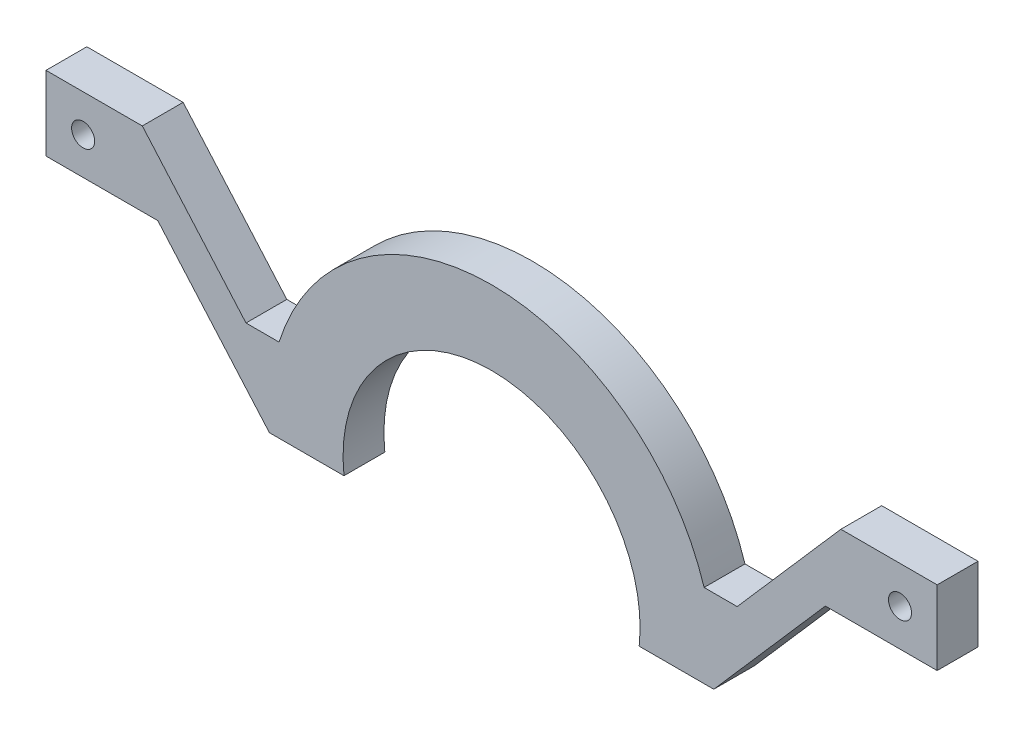
from build123d import *

# Parameters (mm, degrees)
EXTRUDE_1_DEPTH     = 5.5
SKETCH_2_R          = 1.55
CUT_EXTRUDE_1_DEPTH = 65.217448119


with BuildPart() as part:
    # ｽｹｯﾁ1 → ﾎﾞｽ - 押し出し1 (new body)
    with BuildSketch(Plane.XY):
        with BuildLine():
            Line((-60, 5), (-47.033321686, 5))
            Line((-47.033321686, 5), (-33.07098347, -11))
            Line((-33.07098347, -11), (-28.618176043, -11))
            ThreePointArc((-28.618176043, -11), (0, 10), (28.618176043, -11))
            Line((28.618176043, -11), (33.07098347, -11))
            Line((33.07098347, -11), (47.033321686, 5))
            Line((47.033321686, 5), (60, 5))
            Line((60, 5), (60, -5))
            Line((60, -5), (44.942957201, -5))
            Line((44.942957201, -5), (29.917910397, -22.217800138))
            Line((29.917910397, -22.217800138), (19.876653706, -22.217800138))
            ThreePointArc((19.876653706, -22.217800138), (0, 0), (-19.876653706, -22.217800138))
            Line((-19.876653706, -22.217800138), (-29.917910397, -22.217800138))
            Line((-29.917910397, -22.217800138), (-44.942957201, -5))
            Line((-44.942957201, -5), (-60, -5))
            Line((-60, -5), (-60, 5))
        make_face()
    extrude(amount=EXTRUDE_1_DEPTH)

    # ｽｹｯﾁ2 → ｶｯﾄ - 押し出し1 (cut, through all)
    with BuildSketch(Plane.XY.offset(5.5)):
        with Locations((-55, 0)):
            Circle(SKETCH_2_R)
        with Locations((55, 0)):
            Circle(SKETCH_2_R)
    extrude(amount=-CUT_EXTRUDE_1_DEPTH, mode=Mode.SUBTRACT)


solid = part.part
